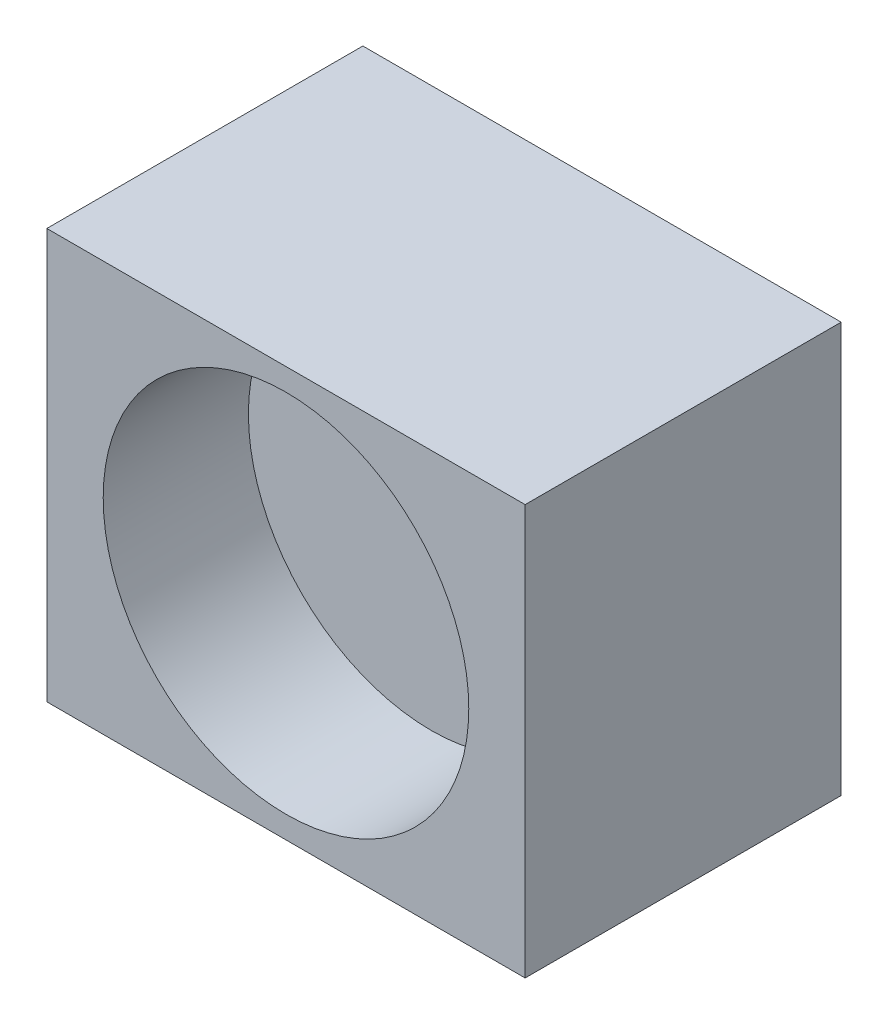
from build123d import *

# Parameters (mm, degrees)
SKETCH1_W           = 56
SKETCH1_H           = 48
BOSS_EXTRUDE1_DEPTH = 37
SKETCH2_R           = 21.4
CUT_EXTRUDE1_DEPTH  = 17
SKETCH4_R           = 2.5
CUT_EXTRUDE2_DEPTH  = 5


with BuildPart() as part:
    # Sketch1 → Boss-Extrude1 (new body)
    with BuildSketch(Plane.XY):
        Rectangle(SKETCH1_W, SKETCH1_H)
    extrude(amount=BOSS_EXTRUDE1_DEPTH)

    # Sketch2 → Cut-Extrude1 (cut)
    with BuildSketch(Plane.XY.offset(37)):
        Circle(SKETCH2_R)
    extrude(amount=-CUT_EXTRUDE1_DEPTH, mode=Mode.SUBTRACT)

    # Sketch4 → Cut-Extrude2 (cut)
    with BuildSketch(Plane.XZ.offset(24)):
        with Locations(Location((-24, 33.5, 0), (0, 0, 270))):
            Circle(SKETCH4_R)
        with Locations(Location((24, 33.5, 0), (0, 0, 270))):
            Circle(SKETCH4_R)
        with Locations(Location((24, 3.5, 0), (0, 0, 270))):
            Circle(SKETCH4_R)
        with Locations(Location((-24, 3.5, 0), (0, 0, 270))):
            Circle(SKETCH4_R)
    extrude(amount=-CUT_EXTRUDE2_DEPTH, mode=Mode.SUBTRACT)


solid = part.part
